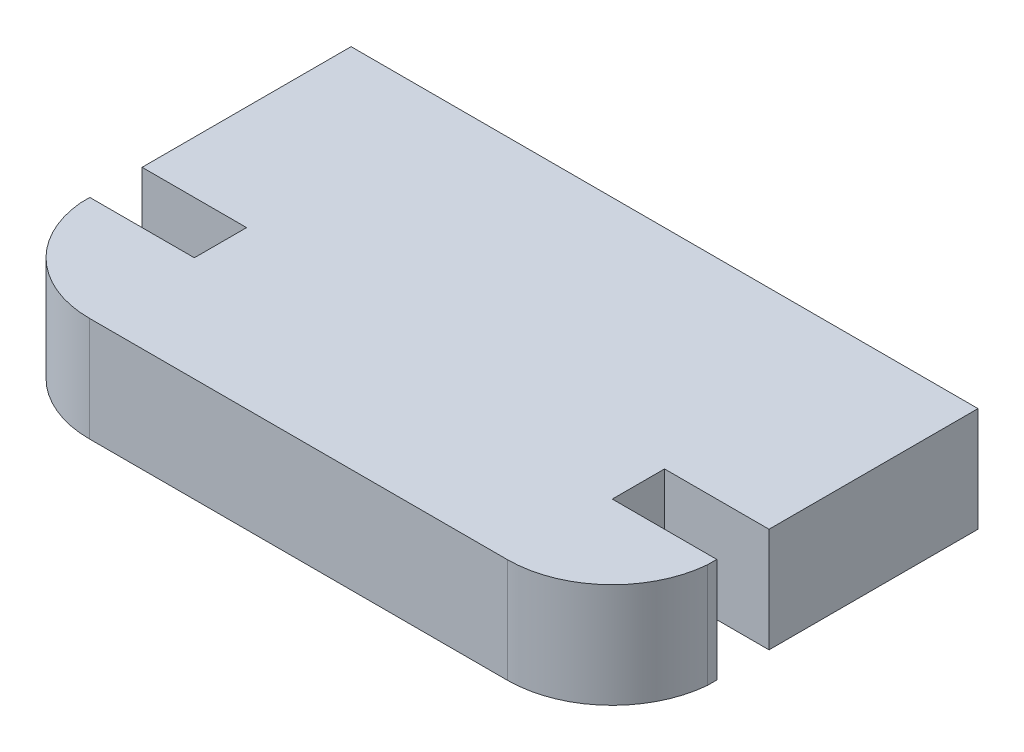
from build123d import *

# Parameters (mm, degrees)
SKETCH1_W           = 19.05
SKETCH1_H           = 11.125
BOSS_EXTRUDE1_DEPTH = 3.175
SKETCH2_W           = 3.175
SKETCH2_H           = 1.5875
CUT_EXTRUDE2_DEPTH  = 3.175


with BuildPart() as part:
    # Sketch1 → Boss-Extrude1 (new body)
    with BuildSketch(Plane(origin=(0, 0, 0), x_dir=(1, 0, 0), z_dir=(0, 1, 0))):
        Rectangle(SKETCH1_W, SKETCH1_H)
    extrude(amount=BOSS_EXTRUDE1_DEPTH)

    # Sketch2 → Cut-Extrude2 (cut)
    with BuildSketch(Plane(origin=(0, 3.175, 0), x_dir=(1, 0, 0), z_dir=(0, 1, 0))):
        with Locations((-7.9375, -1.58125)):
            Rectangle(SKETCH2_W, SKETCH2_H)
        with BuildLine():
            ThreePointArc((-6.35, -5.5625), (-8.501887576, -4.726496568), (-9.525, -2.657012854))
            Line((-9.525, -2.657012854), (-9.525, -5.5625))
            Line((-9.525, -5.5625), (-6.35, -5.5625))
        make_face()
        with BuildLine():
            Line((9.525, -5.5625), (9.525, -2.657012854))
            ThreePointArc((9.525, -2.657012854), (8.501887576, -4.726496568), (6.35, -5.5625))
            Line((6.35, -5.5625), (9.525, -5.5625))
        make_face()
        with Locations((7.9375, -1.58125)):
            Rectangle(SKETCH2_W, SKETCH2_H)
    extrude(amount=-CUT_EXTRUDE2_DEPTH, mode=Mode.SUBTRACT)


solid = part.part
